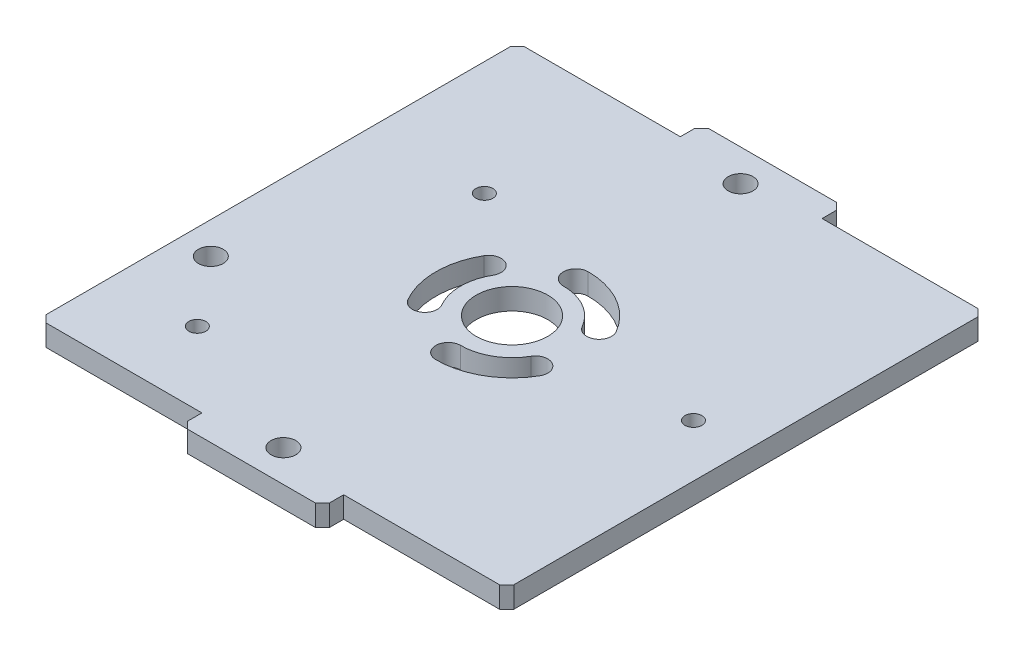
from build123d import *

# Parameters (mm, degrees)
BOSS_EXTRUDE1_DEPTH   = 3
CROQUIS13_W           = 23
CROQUIS13_H           = 3
CORTAR_EXTRUIR3_DEPTH = 81.624127902
CUT_EXTRUDE1_REACH    = 82.624
SKETCH3_R             = 1.2
SKETCH3_R_2           = 5.05
SKETCH3_R_3           = 1.75
CHAFL_N3_SIZE         = 1
CORTAR_EXTRUIR2_DEPTH = 81.624127902


with BuildPart() as part:
    # Sketch1 → Boss-Extrude1 (new body)
    with BuildSketch(Plane(origin=(0, 0, 0), x_dir=(1, 0, 0), z_dir=(0, 1, 0))):
        Polygon((-33, 27.237606732), (-33, 0), (33, 0), (33, 73.5), (-33, 73.5), align=None)
    extrude(amount=BOSS_EXTRUDE1_DEPTH)

    # Croquis13 → Cortar-Extruir3 (cut, through all)
    with BuildSketch(Plane(origin=(0, 3, 0), x_dir=(1, 0, 0), z_dir=(0, 1, 0))):
        with Locations((-21.5, 72)):
            Rectangle(CROQUIS13_W, CROQUIS13_H)
        with Locations((21.5, 72)):
            Rectangle(CROQUIS13_W, CROQUIS13_H)
        with Locations((-21.5, 1.5)):
            Rectangle(CROQUIS13_W, CROQUIS13_H)
        with Locations((21.5, 1.5)):
            Rectangle(CROQUIS13_W, CROQUIS13_H)
    extrude(amount=-CORTAR_EXTRUIR3_DEPTH, mode=Mode.SUBTRACT)

    # Sketch3 → Cut-Extrude1 (cut, up to next)
    with BuildSketch(Plane(origin=(0, 3, 0), x_dir=(1, 0, 0), z_dir=(0, 1, 0)), mode=Mode.PRIVATE) as cut_extrude1_sk1:
        with Locations(Location((-20.9, 13.25, 0), (0, 0, 270))):
            Circle(SKETCH3_R)
    cut_extrude1_tool1 = extrude(cut_extrude1_sk1.sketch, amount=-CUT_EXTRUDE1_REACH, mode=Mode.PRIVATE) & part.part
    # Sketch3 → Cut-Extrude1 (cut, up to next)
    with BuildSketch(Plane(origin=(0, 3, 0), x_dir=(1, 0, 0), z_dir=(0, 1, 0)), mode=Mode.PRIVATE) as cut_extrude1_sk2:
        with Locations(Location((0, 36.75, 0), (0, 0, 270))):
            Circle(SKETCH3_R_2)
    cut_extrude1_tool2 = extrude(cut_extrude1_sk2.sketch, amount=-CUT_EXTRUDE1_REACH, mode=Mode.PRIVATE) & part.part
    # Sketch3 → Cut-Extrude1 (cut, up to next)
    with BuildSketch(Plane(origin=(0, 3, 0), x_dir=(1, 0, 0), z_dir=(0, 1, 0)), mode=Mode.PRIVATE) as cut_extrude1_sk3:
        with Locations(Location((-16.9, 49.75, 0), (0, 0, 270))):
            Circle(SKETCH3_R)
    cut_extrude1_tool3 = extrude(cut_extrude1_sk3.sketch, amount=-CUT_EXTRUDE1_REACH, mode=Mode.PRIVATE) & part.part
    # Sketch3 → Cut-Extrude1 (cut, up to next)
    with BuildSketch(Plane(origin=(0, 3, 0), x_dir=(1, 0, 0), z_dir=(0, 1, 0)), mode=Mode.PRIVATE) as cut_extrude1_sk4:
        with Locations(Location((25.6, 36.75, 0), (0, 0, 270))):
            Circle(SKETCH3_R)
    cut_extrude1_tool4 = extrude(cut_extrude1_sk4.sketch, amount=-CUT_EXTRUDE1_REACH, mode=Mode.PRIVATE) & part.part
    # Sketch3 → Cut-Extrude1 (cut, up to next)
    with BuildSketch(Plane(origin=(0, 3, 0), x_dir=(1, 0, 0), z_dir=(0, 1, 0)), mode=Mode.PRIVATE) as cut_extrude1_sk5:
        with Locations(Location((0, 4.5, 0), (0, 0, 270))):
            Circle(SKETCH3_R_3)
    cut_extrude1_tool5 = extrude(cut_extrude1_sk5.sketch, amount=-CUT_EXTRUDE1_REACH, mode=Mode.PRIVATE) & part.part
    # Sketch3 → Cut-Extrude1 (cut, up to next)
    with BuildSketch(Plane(origin=(0, 3, 0), x_dir=(1, 0, 0), z_dir=(0, 1, 0)), mode=Mode.PRIVATE) as cut_extrude1_sk6:
        with Locations(Location((0, 69, 0), (0, 0, 270))):
            Circle(SKETCH3_R_3)
    cut_extrude1_tool6 = extrude(cut_extrude1_sk6.sketch, amount=-CUT_EXTRUDE1_REACH, mode=Mode.PRIVATE) & part.part
    # Sketch3 → Cut-Extrude1 (cut, up to next)
    with BuildSketch(Plane(origin=(0, 3, 0), x_dir=(1, 0, 0), z_dir=(0, 1, 0)), mode=Mode.PRIVATE) as cut_extrude1_sk7:
        with Locations(Location((-28.5, 22.75, 0), (0, 0, 270))):
            Circle(SKETCH3_R_3)
    cut_extrude1_tool7 = extrude(cut_extrude1_sk7.sketch, amount=-CUT_EXTRUDE1_REACH, mode=Mode.PRIVATE) & part.part
    add(cut_extrude1_tool1.solids().sort_by_distance((-20.9, 3, -13.25))[0], mode=Mode.SUBTRACT)
    add(cut_extrude1_tool2.solids().sort_by_distance((0, 3, -36.75))[0], mode=Mode.SUBTRACT)
    add(cut_extrude1_tool3.solids().sort_by_distance((-16.9, 3, -49.75))[0], mode=Mode.SUBTRACT)
    add(cut_extrude1_tool4.solids().sort_by_distance((25.6, 3, -36.75))[0], mode=Mode.SUBTRACT)
    add(cut_extrude1_tool5.solids().sort_by_distance((0, 3, -4.5))[0], mode=Mode.SUBTRACT)
    add(cut_extrude1_tool6.solids().sort_by_distance((0, 3, -69))[0], mode=Mode.SUBTRACT)
    add(cut_extrude1_tool7.solids().sort_by_distance((-28.5, 3, -22.75))[0], mode=Mode.SUBTRACT)

    # Chaflán3
    chafl_n3_edges = [part.edges().sort_by_distance(p)[0] for p in [
        (-33, 1.5, -70.5),
        (-10, 1.5, -73.5),
        (33, 1.5, -70.5),
        (10, 1.5, -73.5),
        (-33, 1.5, -3),
        (-10, 1.5, 0),
        (33, 1.5, -3),
        (10, 1.5, 0),
    ]]
    chamfer(chafl_n3_edges, length=CHAFL_N3_SIZE)

    # Croquis12 → Cortar-Extruir2 (cut, through all)
    with BuildSketch(Plane(origin=(0, 3, 0), x_dir=(1, 0, 0), z_dir=(0, 1, 0))):
        with BuildLine():
            ThreePointArc((-9.309773091, 42.125), (-10.75, 36.75), (-9.309773091, 31.375))
            ThreePointArc((-9.309773091, 31.375), (-6.919228634, 30.734455543), (-6.278684177, 33.125))
            ThreePointArc((-6.278684177, 33.125), (-7.25, 36.75), (-6.278684177, 40.375))
            ThreePointArc((-6.278684177, 40.375), (-6.919228634, 42.765544457), (-9.309773091, 42.125))
        make_face()
        with BuildLine():
            ThreePointArc((9.309773091, 42.125), (5.375, 46.059773091), (0, 47.5))
            ThreePointArc((0, 47.5), (-1.75, 45.75), (0, 44))
            ThreePointArc((0, 44), (3.625, 43.028684177), (6.278684177, 40.375))
            ThreePointArc((6.278684177, 40.375), (8.669228634, 39.734455543), (9.309773091, 42.125))
        make_face()
        with BuildLine():
            ThreePointArc((0, 26), (5.375, 27.440226909), (9.309773091, 31.375))
            ThreePointArc((9.309773091, 31.375), (8.669228634, 33.765544457), (6.278684177, 33.125))
            ThreePointArc((6.278684177, 33.125), (3.625, 30.471315823), (0, 29.5))
            ThreePointArc((0, 29.5), (-1.75, 27.75), (0, 26))
        make_face()
    extrude(amount=-CORTAR_EXTRUIR2_DEPTH, mode=Mode.SUBTRACT)


solid = part.part
